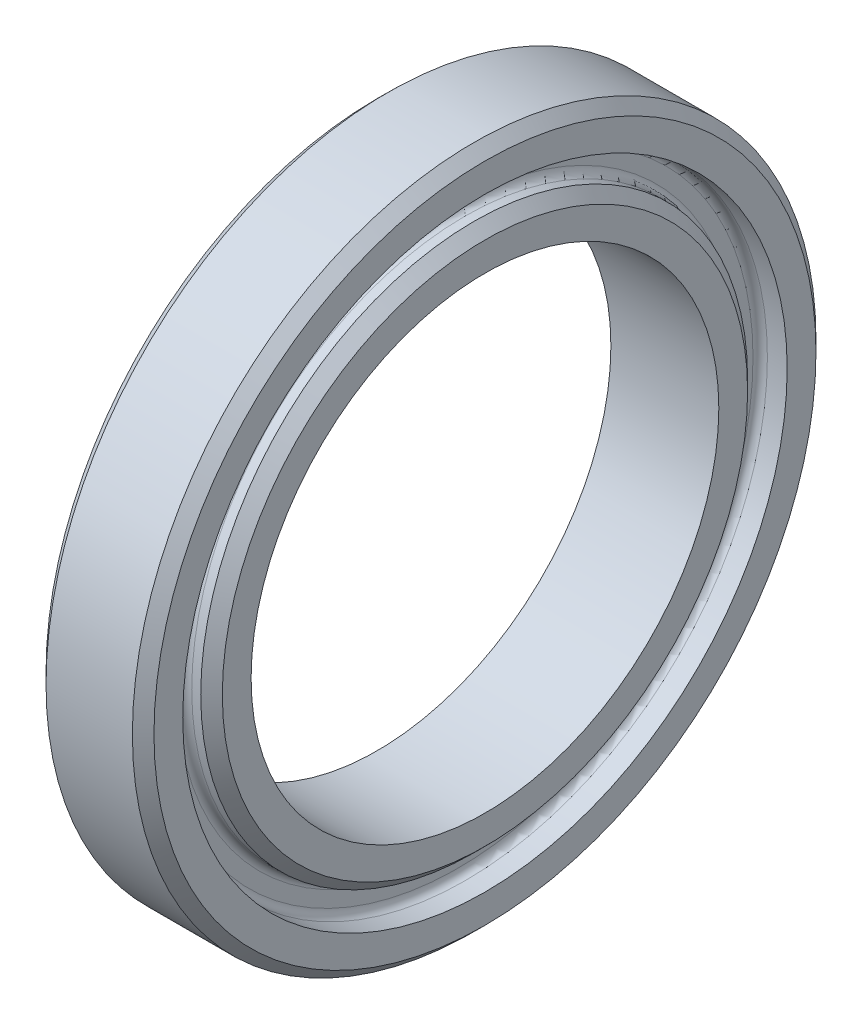
from build123d import *

# Parameters (mm, degrees)
ZAOKR_GLENIE2_R  = 2
SFAZOWANIE1_SIZE = 3


with BuildPart() as part:
    # Szkic1 → Obrót1 (revolve)
    with BuildSketch(Plane(origin=(0, 0, 0), x_dir=(1, 0, 0), z_dir=(0, 1, 0))):
        Polygon((15, 65), (-15, 65), (-15, 76), (-7.5, 76), (-7.5, 84), (-15, 84), (-15, 95), (15, 95), (15, 84), (7.5, 84), (7.5, 76), (15, 76), align=None)
    revolve(axis=Axis((0, 0, 0), (-1, 0, 0)))

    # Zaokrąglenie2
    zaokr_glenie2_edges = [part.edges().sort_by_distance(p)[0] for p in [
        (-7.5, 0, 84),
        (7.5, 0, 84),
        (7.5, 0, 76),
    ]]
    fillet(zaokr_glenie2_edges, radius=ZAOKR_GLENIE2_R)

    # Sfazowanie1
    sfazowanie1_edges = [part.edges().sort_by_distance(p)[0] for p in [
        (15, 0, 76),
        (-15, 0, 76),
        (-15, 0, 95),
        (15, 0, 95),
    ]]
    chamfer(sfazowanie1_edges, length=SFAZOWANIE1_SIZE)


solid = part.part
